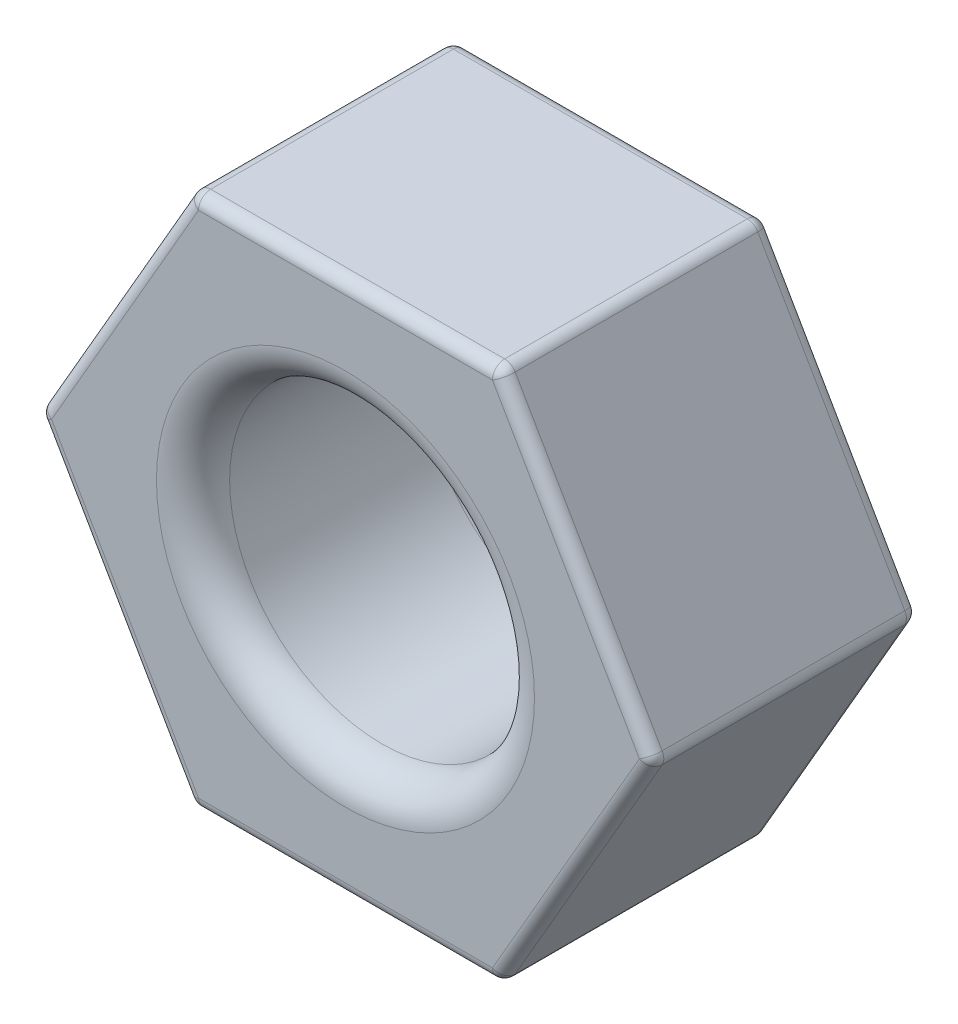
from build123d import *

# Parameters (mm, degrees)
SKETCH1_R           = 3.175
BOSS_EXTRUDE1_DEPTH = 5.5626
FILLET1_R           = 0.254
FILLET2_R           = 0.762


with BuildPart() as part:
    # Sketch1 → Boss-Extrude1 (new body)
    with BuildSketch(Plane.XY):
        Polygon((3.207902433, -5.55625), (6.415804866, 0), (3.207902433, 5.55625), (-3.207902433, 5.55625), (-6.415804866, 0), (-3.207902433, -5.55625), align=None)
        with Locations(Location((0, 0, 0), (0, 0, 180))):
            Circle(SKETCH1_R, mode=Mode.SUBTRACT)
    extrude(amount=BOSS_EXTRUDE1_DEPTH)

    # Fillet1
    fillet1_edges = [part.edges().sort_by_distance(p)[0] for p in [
        (-4.81185365, 2.778125, 5.5626),
        (6.415804866, 0, 2.7813),
        (3.207902433, -5.55625, 2.7813),
        (-3.207902433, -5.55625, 2.7813),
        (-6.415804866, 0, 2.7813),
        (-3.207902433, 5.55625, 2.7813),
        (3.207902433, 5.55625, 2.7813),
        (-4.81185365, -2.778125, 5.5626),
        (0, -5.55625, 5.5626),
        (4.81185365, -2.778125, 5.5626),
        (4.81185365, 2.778125, 5.5626),
        (4.81185365, -2.778125, 0),
        (0, -5.55625, 0),
        (-4.81185365, -2.778125, 0),
        (0, 5.55625, 5.5626),
        (-4.81185365, 2.778125, 0),
        (0, 5.55625, 0),
        (4.81185365, 2.778125, 0),
    ]]
    fillet(fillet1_edges, radius=FILLET1_R)

    # Fillet2
    fillet2_edges = [part.edges().sort_by_distance(p)[0] for p in [
        (3.175, 0, 0),
        (3.175, 0, 5.5626),
    ]]
    fillet(fillet2_edges, radius=FILLET2_R)


solid = part.part
